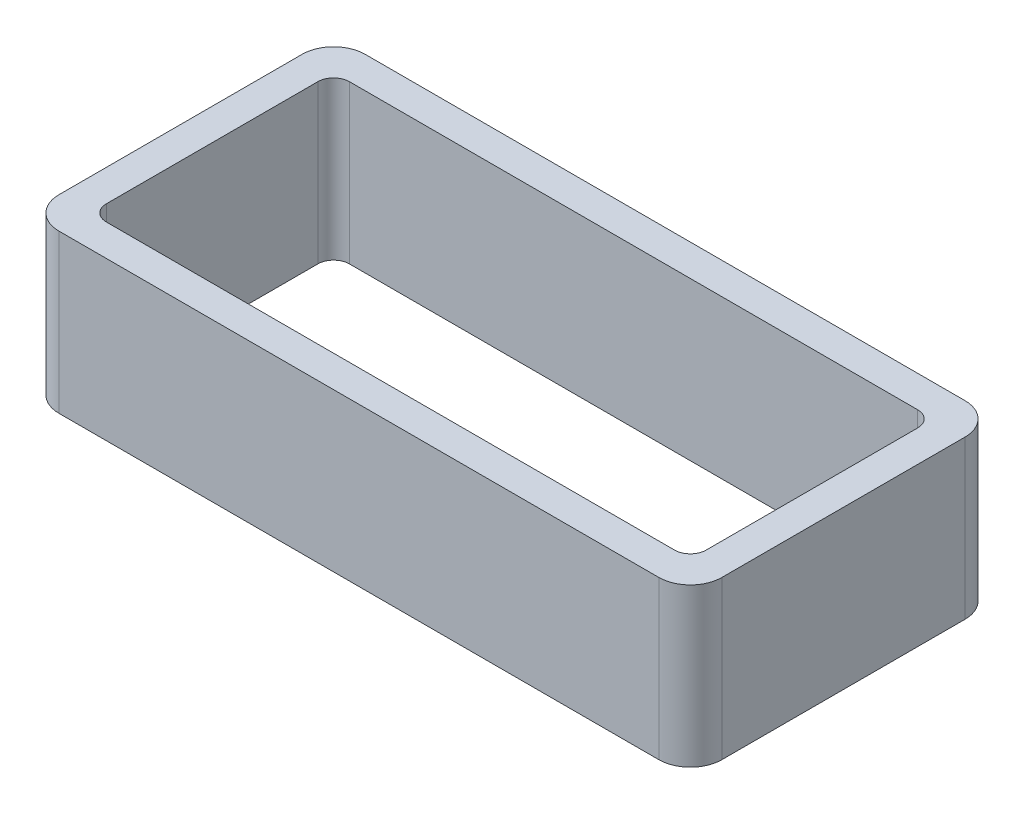
from build123d import *

# Parameters (mm, degrees)
EXTRUDE_1_DEPTH = 5


with BuildPart() as part:
    # Эскиз1 → Бобышка-Вытянуть1 (new body)
    with BuildSketch(Plane(origin=(0, 0, 0), x_dir=(1, 0, 0), z_dir=(0, 1, 0))):
        with BuildLine():
            Line((-10.5, 3.85), (-10.5, -3.85))
            ThreePointArc((-10.5, -3.85), (-10.207106781, -4.557106781), (-9.5, -4.85))
            Line((-9.5, -4.85), (9.5, -4.85))
            ThreePointArc((9.5, -4.85), (10.207106781, -4.557106781), (10.5, -3.85))
            Line((10.5, -3.85), (10.5, 3.85))
            ThreePointArc((10.5, 3.85), (10.207106781, 4.557106781), (9.5, 4.85))
            Line((9.5, 4.85), (-9.5, 4.85))
            ThreePointArc((-9.5, 4.85), (-10.207106781, 4.557106781), (-10.5, 3.85))
        make_face()
        with BuildLine():
            Line((-9, 3.85), (9, 3.85))
            ThreePointArc((9, 3.85), (9.353553391, 3.703553391), (9.5, 3.35))
            Line((9.5, 3.35), (9.5, -3.35))
            ThreePointArc((9.5, -3.35), (9.353553391, -3.703553391), (9, -3.85))
            Line((9, -3.85), (-9, -3.85))
            ThreePointArc((-9, -3.85), (-9.353553391, -3.703553391), (-9.5, -3.35))
            Line((-9.5, -3.35), (-9.5, 3.35))
            ThreePointArc((-9.5, 3.35), (-9.353553391, 3.703553391), (-9, 3.85))
        make_face(mode=Mode.SUBTRACT)
    extrude(amount=EXTRUDE_1_DEPTH)


solid = part.part
